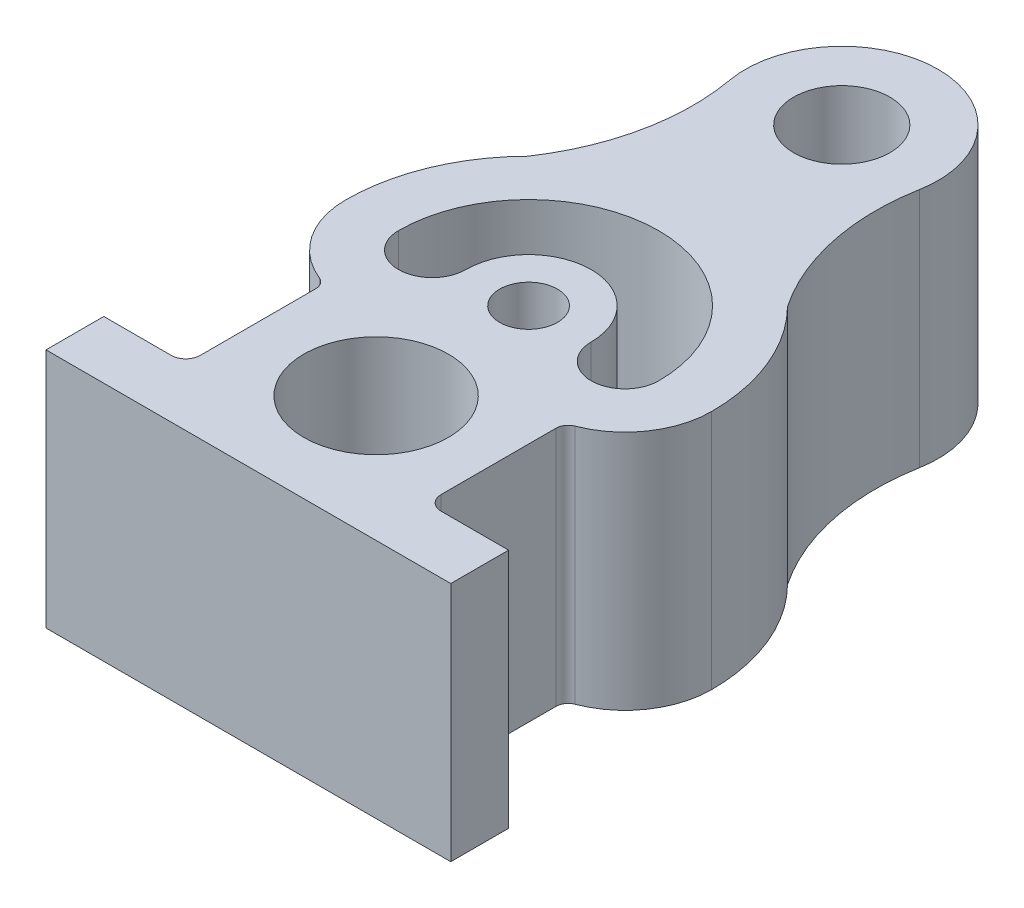
from build123d import *

# Parameters (mm, degrees)
SKETCH1_R           = 30
SKETCH1_R_2         = 12
SKETCH1_R_3         = 20
BOSS_EXTRUDE1_DEPTH = 100


with BuildPart() as part:
    # Sketch1 → Boss-Extrude1 (new body)
    with BuildSketch(Plane(origin=(0, 0, 0), x_dir=(1, 0, 0), z_dir=(0, 1, 0))):
        with BuildLine():
            Line((-84.293098865, -116), (83.706901135, -116))
            Line((83.706901135, -116), (83.706901135, -92))
            Line((83.706901135, -92), (55.706901135, -92))
            ThreePointArc((55.706901135, -92), (51.464260447, -90.242640687), (49.706901135, -86))
            Line((49.706901135, -86), (49.706901135, -38.271491466))
            ThreePointArc((49.706901135, -38.271491466), (50.585759142, -35.440204006), (52.913376606, -33.604236409))
            ThreePointArc((52.913376606, -33.604236409), (69.672222345, -20.385269709), (76, 0))
            ThreePointArc((76, 0), (70.285133563, 28.91366459), (54, 53.478967828))
            ThreePointArc((54, 53.478967828), (39.883656587, 86.745545299), (39.361130578, 122.87950847))
            ThreePointArc((39.361130578, 122.87950847), (0, 170), (-39.361130578, 122.87950847))
            ThreePointArc((-39.361130578, 122.87950847), (-39.883656587, 86.745545299), (-54, 53.478967828))
            ThreePointArc((-54, 53.478967828), (-70.285133563, 28.91366459), (-76, 0))
            ThreePointArc((-76, 0), (-69.827932589, -20.156746698), (-53.428086809, -33.401893429))
            ThreePointArc((-53.428086809, -33.401893429), (-51.15033045, -35.241497142), (-50.293098865, -38.041045294))
            Line((-50.293098865, -38.041045294), (-50.293098865, -86))
            ThreePointArc((-50.293098865, -86), (-52.050458178, -90.242640687), (-56.293098865, -92))
            Line((-56.293098865, -92), (-84.293098865, -92))
            Line((-84.293098865, -92), (-84.293098865, -116))
        make_face()
        with Locations(Location((0.719405778, -64, 0), (0, 0, 270))):
            Circle(SKETCH1_R, mode=Mode.SUBTRACT)
        with Locations(Location((0, 0, 0), (0, 0, 270))):
            Circle(SKETCH1_R_2, mode=Mode.SUBTRACT)
        with Locations(Location((0, 130, 0), (0, 0, 270))):
            Circle(SKETCH1_R_3, mode=Mode.SUBTRACT)
        with BuildLine():
            ThreePointArc((-54, 0), (-40, -14), (-26, 0))
            ThreePointArc((-26, 0), (0, 26), (26, 0))
            ThreePointArc((26, 0), (40, -14), (54, 0))
            ThreePointArc((54, 0), (0, 54), (-54, 0))
        make_face(mode=Mode.SUBTRACT)
    extrude(amount=BOSS_EXTRUDE1_DEPTH)


solid = part.part
